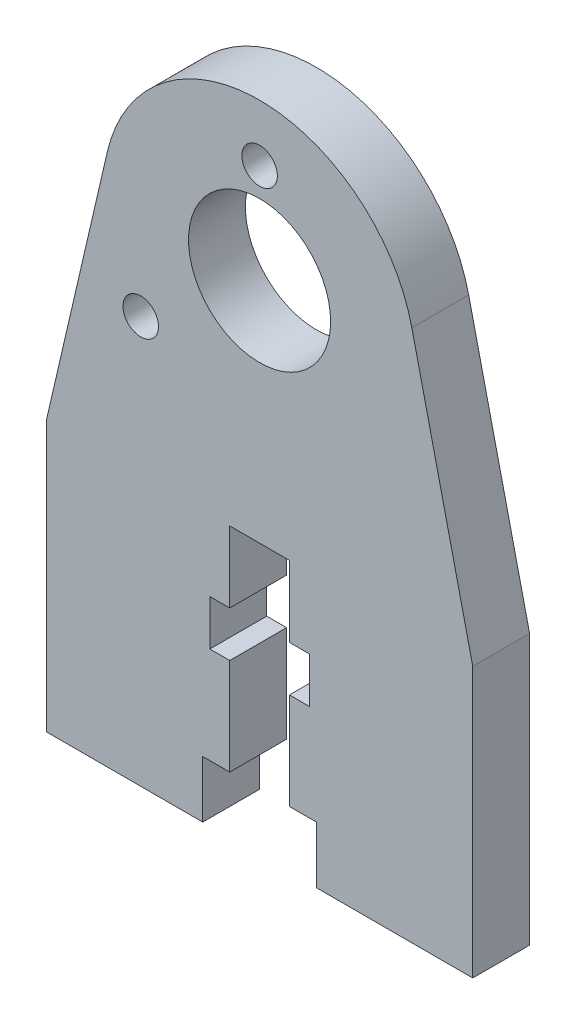
from build123d import *

# Parameters (mm, degrees)
SKETCH6_R           = 5
BOSS_EXTRUDE5_DEPTH = 4
SKETCH10_R          = 1.25
CUT_EXTRUDE6_DEPTH  = 45.777226354
CUT_EXTRUDE7_DEPTH  = 45.777226354


with BuildPart() as part:
    # Sketch6 → Boss-Extrude5 (new body)
    with BuildSketch(Plane.XY):
        with BuildLine():
            Line((15, 0), (15, 15))
            Line((15, 15), (10.715935986, 33.483689987))
            ThreePointArc((10.715935986, 33.483689987), (0, 42), (-10.715935986, 33.483689987))
            Line((-10.715935986, 33.483689987), (-15, 15))
            Line((-15, 15), (-15, 0))
            Line((-15, 0), (-15, -4))
            Line((-15, -4), (-4, -4))
            Line((-4, -4), (-4, 0))
            Line((-4, 0), (4, 0))
            Line((4, 0), (4, -4))
            Line((4, -4), (15, -4))
            Line((15, -4), (15, 0))
        make_face()
        with Locations((0, 31)):
            Circle(SKETCH6_R, mode=Mode.SUBTRACT)
    extrude(amount=BOSS_EXTRUDE5_DEPTH)

    # Sketch10 → Cut-Extrude6 (cut, through all)
    with BuildSketch(Plane(origin=(0, 0, 0), x_dir=(-1, 0, 0), z_dir=(0, 0, -1))):
        with Locations((0, 38)):
            Circle(SKETCH10_R)
        with Locations((4.949747468, 44.949747468)):
            Circle(SKETCH10_R)
        with Locations((13.363961031, 46.363961031)):
            Circle(SKETCH10_R)
        with Locations((20.313708499, 41.414213562)):
            Circle(SKETCH10_R)
        with Locations((21.727922061, 33)):
            Circle(SKETCH10_R)
        with Locations((16.778174593, 26.050252532)):
            Circle(SKETCH10_R)
        with Locations((8.363961031, 24.636038969)):
            Circle(SKETCH10_R)
        with Locations((1.414213562, 29.585786438)):
            Circle(SKETCH10_R)
    extrude(amount=-CUT_EXTRUDE6_DEPTH, mode=Mode.SUBTRACT)

    # Sketch11 → Cut-Extrude7 (cut, through all)
    with BuildSketch(Plane.XY.offset(4)):
        Polygon((-2.1, 10), (-2.1, 15), (2.1, 15), (2.1, 10), (3.5, 10), (3.5, 6.8), (2.1, 6.8), (2.1, 0), (-2.1, 0), (-2.1, 6.8), (-3.5, 6.8), (-3.5, 10), align=None)
    extrude(amount=-CUT_EXTRUDE7_DEPTH, mode=Mode.SUBTRACT)


solid = part.part
